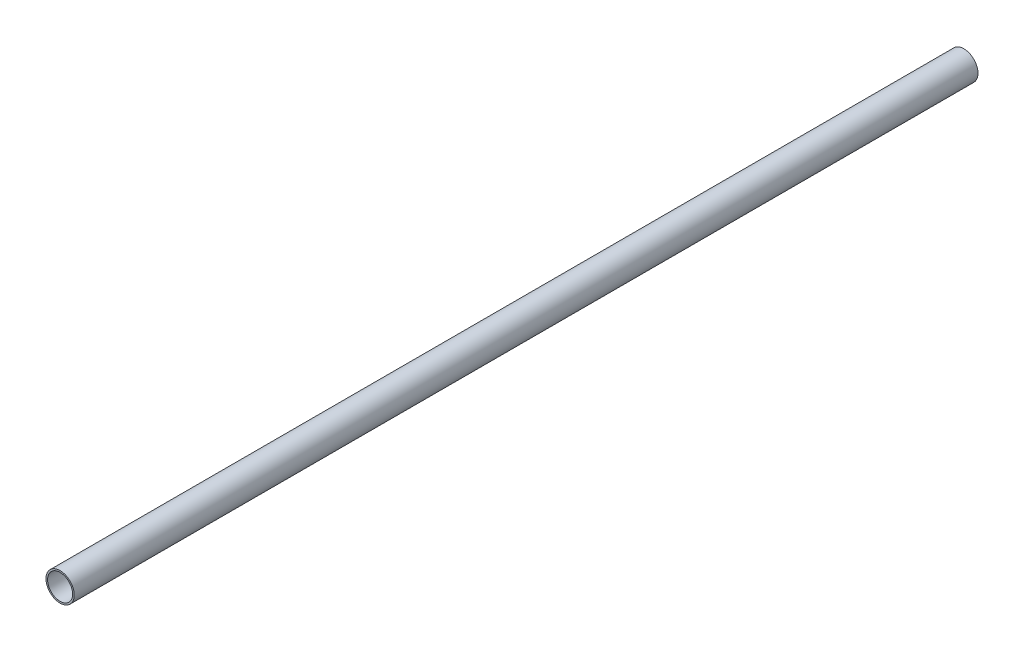
from build123d import *

# Parameters (mm, degrees)
EXTRUDE_TUBE_BODY_DEPTH       = 254
EXTRUDE_TUBE_BODY_DEPTH_BACK  = 254
SKETCH_TUBE_CROSS_SECTION_R   = 7.9375
SKETCH_TUBE_CROSS_SECTION_R_2 = 7.0485


with BuildPart() as part:
    # Sketch - Tube cross section → Extrude - Tube body (new, two sides: drawn at the far end of the back side and taken through both)
    with BuildSketch(Plane.XY.offset(-EXTRUDE_TUBE_BODY_DEPTH_BACK)):
        Circle(SKETCH_TUBE_CROSS_SECTION_R)
        Circle(SKETCH_TUBE_CROSS_SECTION_R_2, mode=Mode.SUBTRACT)
    extrude(amount=EXTRUDE_TUBE_BODY_DEPTH + EXTRUDE_TUBE_BODY_DEPTH_BACK)


solid = part.part
